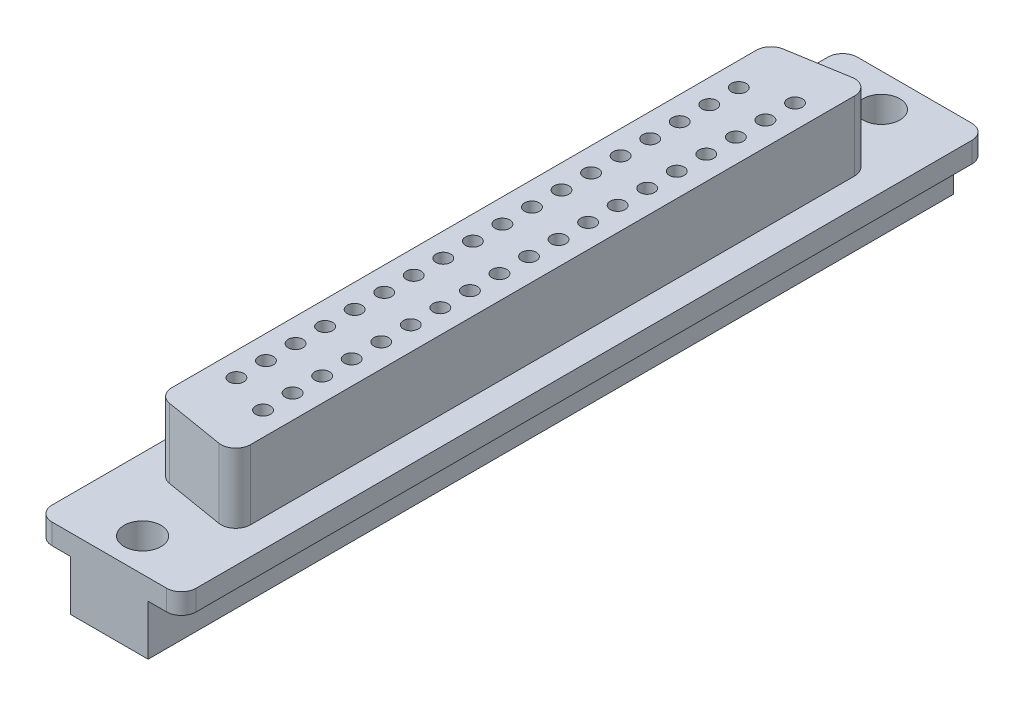
from build123d import *

# Parameters (mm, degrees)
SKETCH1_W      = 6.6675
SKETCH1_H      = 69.215
EXTRUDE1_DEPTH = 4.318
EXTRUDE2_DEPTH = 1.7653
EXTRUDE3_DEPTH = 5.969
SKETCH4_R      = 1.5875
EXTRUDE4_DEPTH = 71.131650408
SKETCH5_R      = 0.635
EXTRUDE5_DEPTH = 6.35


with BuildPart() as part:
    # Sketch1 → Extrude1 (new body)
    with BuildSketch(Plane(origin=(0, 0, 0), x_dir=(1, 0, 0), z_dir=(0, 1, 0))):
        with Locations((3.33375, 34.6075)):
            Rectangle(SKETCH1_W, SKETCH1_H)
    extrude(amount=EXTRUDE1_DEPTH)

    # Sketch2 → Extrude2 (add)
    with BuildSketch(Plane(origin=(0, 4.318, 0), x_dir=(1, 0, 0), z_dir=(0, 1, 0))):
        with BuildLine():
            Line((-1.5875, 69.215), (8.255, 69.215))
            ThreePointArc((8.255, 69.215), (9.153025612, 68.843025612), (9.525, 67.945))
            Line((9.525, 67.945), (9.525, 1.27))
            ThreePointArc((9.525, 1.27), (9.153025612, 0.371974388), (8.255, 0))
            Line((8.255, 0), (-1.5875, 0))
            ThreePointArc((-1.5875, 0), (-2.485525612, 0.371974388), (-2.8575, 1.27))
            Line((-2.8575, 1.27), (-2.8575, 67.945))
            ThreePointArc((-2.8575, 67.945), (-2.485525612, 68.843025612), (-1.5875, 69.215))
        make_face()
    extrude(amount=EXTRUDE2_DEPTH)

    # Sketch3 → Extrude3 (add)
    with BuildSketch(Plane(origin=(0, 6.0833, 0), x_dir=(1, 0, 0), z_dir=(0, 1, 0))):
        with BuildLine():
            Line((-0.47625, 59.407898598), (-0.47625, 9.172101402))
            ThreePointArc((-0.47625, 9.172101402), (-0.175285378, 8.351205284), (0.584963286, 7.919381119))
            Line((0.584963286, 7.919381119), (5.664963286, 7.072714452))
            ThreePointArc((5.664963286, 7.072714452), (6.694646118, 7.356399358), (7.14375, 8.325434736))
            Line((7.14375, 8.325434736), (7.14375, 60.254565264))
            ThreePointArc((7.14375, 60.254565264), (6.694646118, 61.223600642), (5.664963286, 61.507285548))
            Line((5.664963286, 61.507285548), (0.584963286, 60.660618881))
            ThreePointArc((0.584963286, 60.660618881), (-0.175285378, 60.228794716), (-0.47625, 59.407898598))
        make_face()
    extrude(amount=EXTRUDE3_DEPTH)

    # Sketch4 → Extrude4 (cut, through all)
    with BuildSketch(Plane(origin=(0, 6.0833, 0), x_dir=(1, 0, 0), z_dir=(0, 1, 0))):
        with Locations(Location((3.33375, 66.3575, 0), (0, 0, 270))):
            Circle(SKETCH4_R)
        with Locations(Location((3.33375, 2.8575, 0), (0, 0, 270))):
            Circle(SKETCH4_R)
    extrude(amount=-EXTRUDE4_DEPTH, mode=Mode.SUBTRACT)

    # Sketch5 → Extrude5 (cut)
    with BuildSketch(Plane(origin=(0, 12.0523, 0), x_dir=(1, 0, 0), z_dir=(0, 1, 0))):
        with Locations((5.11175, 57.15)):
            Circle(SKETCH5_R)
        with Locations((1.55575, 55.88)):
            Circle(SKETCH5_R)
        with Locations((5.11175, 54.61)):
            Circle(SKETCH5_R)
        with Locations((5.11175, 52.07)):
            Circle(SKETCH5_R)
        with Locations((5.11175, 49.53)):
            Circle(SKETCH5_R)
        with Locations((5.11175, 46.99)):
            Circle(SKETCH5_R)
        with Locations((5.11175, 44.45)):
            Circle(SKETCH5_R)
        with Locations((5.11175, 41.91)):
            Circle(SKETCH5_R)
        with Locations((5.11175, 39.37)):
            Circle(SKETCH5_R)
        with Locations((5.11175, 36.83)):
            Circle(SKETCH5_R)
        with Locations((5.11175, 34.29)):
            Circle(SKETCH5_R)
        with Locations((5.11175, 31.75)):
            Circle(SKETCH5_R)
        with Locations((5.11175, 29.21)):
            Circle(SKETCH5_R)
        with Locations((5.11175, 26.67)):
            Circle(SKETCH5_R)
        with Locations((5.11175, 24.13)):
            Circle(SKETCH5_R)
        with Locations((5.11175, 21.59)):
            Circle(SKETCH5_R)
        with Locations((5.11175, 19.05)):
            Circle(SKETCH5_R)
        with Locations((5.11175, 16.51)):
            Circle(SKETCH5_R)
        with Locations((5.11175, 13.97)):
            Circle(SKETCH5_R)
        with Locations((5.11175, 11.43)):
            Circle(SKETCH5_R)
        with Locations((1.55575, 53.34)):
            Circle(SKETCH5_R)
        with Locations((1.55575, 50.8)):
            Circle(SKETCH5_R)
        with Locations((1.55575, 48.26)):
            Circle(SKETCH5_R)
        with Locations((1.55575, 45.72)):
            Circle(SKETCH5_R)
        with Locations((1.55575, 43.18)):
            Circle(SKETCH5_R)
        with Locations((1.55575, 40.64)):
            Circle(SKETCH5_R)
        with Locations((1.55575, 38.1)):
            Circle(SKETCH5_R)
        with Locations((1.55575, 35.56)):
            Circle(SKETCH5_R)
        with Locations((1.55575, 33.02)):
            Circle(SKETCH5_R)
        with Locations((1.55575, 30.48)):
            Circle(SKETCH5_R)
        with Locations((1.55575, 27.94)):
            Circle(SKETCH5_R)
        with Locations((1.55575, 25.4)):
            Circle(SKETCH5_R)
        with Locations((1.55575, 22.86)):
            Circle(SKETCH5_R)
        with Locations((1.55575, 20.32)):
            Circle(SKETCH5_R)
        with Locations((1.55575, 17.78)):
            Circle(SKETCH5_R)
        with Locations((1.55575, 15.24)):
            Circle(SKETCH5_R)
        with Locations((1.55575, 12.7)):
            Circle(SKETCH5_R)
    extrude(amount=-EXTRUDE5_DEPTH, mode=Mode.SUBTRACT)


solid = part.part
